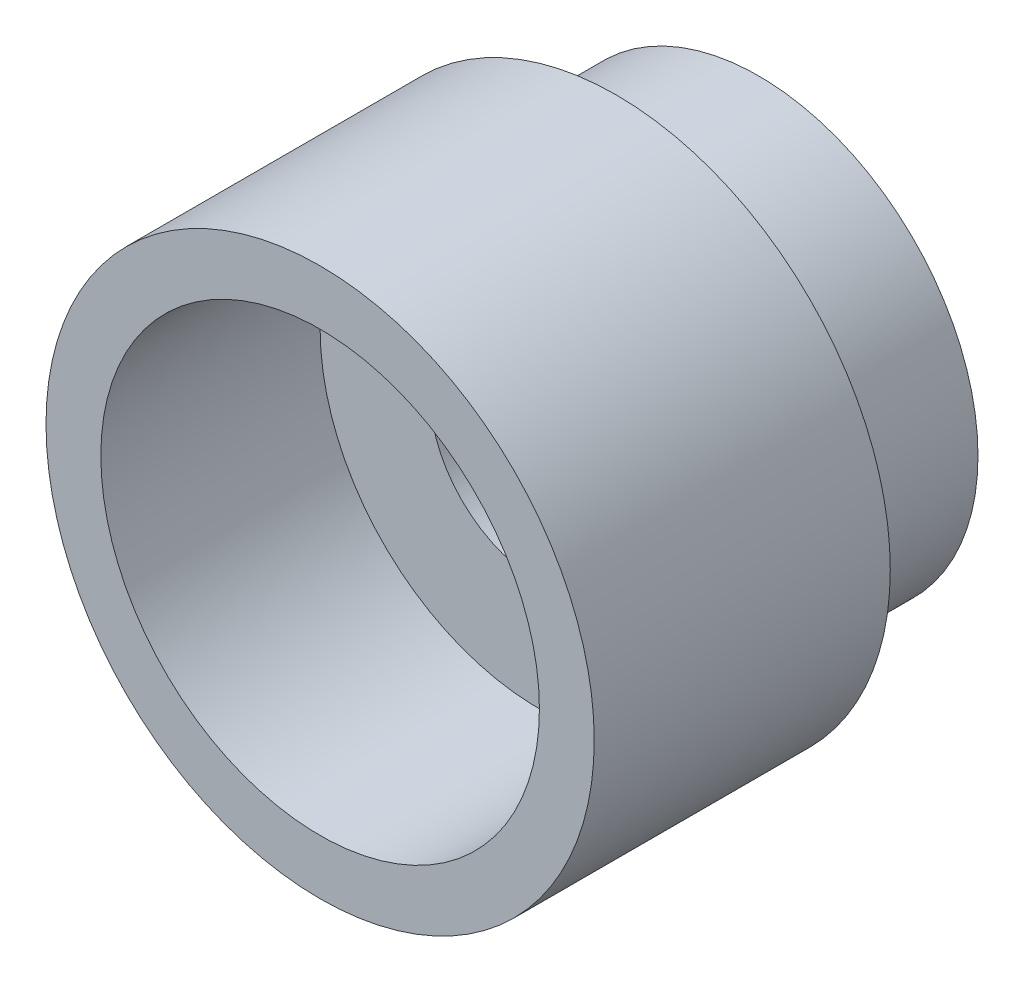
from build123d import *


with BuildPart() as part:
    # Sketch1 → Revolve1 (revolve)
    with BuildSketch(Plane(origin=(0, 0, 0), x_dir=(0, 0, -1), z_dir=(1, 0, 0)), mode=Mode.PRIVATE) as revolve1_sk:
        Polygon((0, 2.5), (2.7, 2.5), (2.7, 2), (4, 2), (4, 1), (2, 1), (2, 2), (0, 2), align=None)
    revolve(revolve1_sk.sketch.rotate(Axis((0, 0, 114.968048005), (0, 0, -1)), 90), axis=Axis((0, 0, 114.968048005), (0, 0, -1)))


solid = part.part
